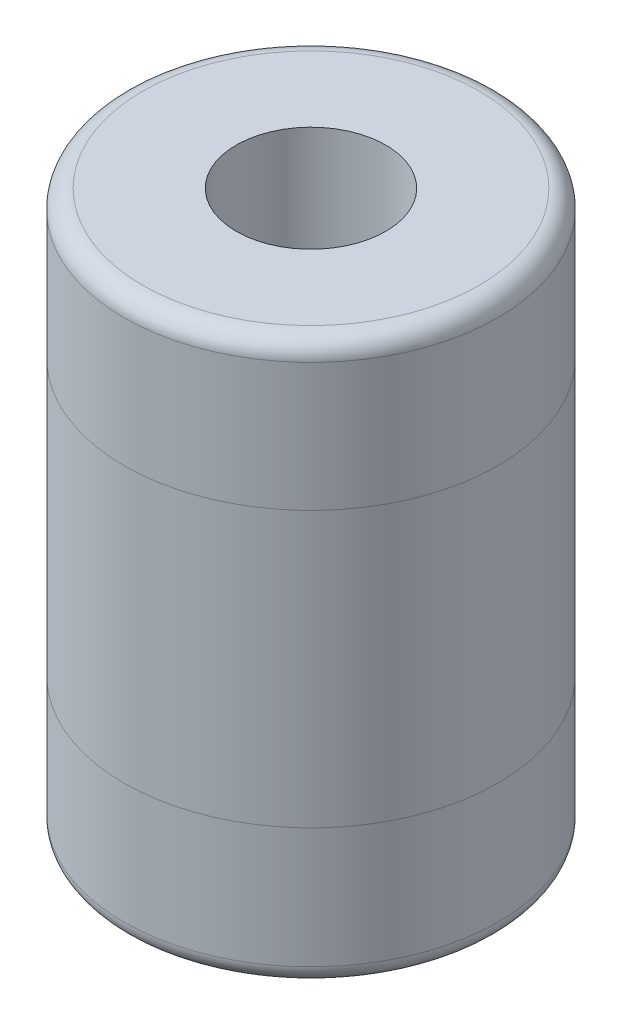
from build123d import *

# Parameters (mm, degrees)
SKETCH1_R           = 10
BOSS_EXTRUDE1_DEPTH = 15
SKETCH2_R           = 4
CUT_EXTRUDE1_DEPTH  = 34.166247904
FILLET1_R           = 1


with BuildPart() as part:
    # Sketch1 → Boss-Extrude1 (new, symmetric)
    with BuildSketch(Plane(origin=(0, 0, 0), x_dir=(1, 0, 0), z_dir=(0, 1, 0))):
        with Locations(Location((0, 0, 0), (0, 0, 270))):
            Circle(SKETCH1_R)
    extrude(amount=BOSS_EXTRUDE1_DEPTH, both=True)

    # Sketch2 → Cut-Extrude1 (cut, through all)
    with BuildSketch(Plane(origin=(0, 15, 0), x_dir=(1, 0, 0), z_dir=(0, 1, 0))):
        with Locations(Location((0, 0, 0), (0, 0, 270))):
            Circle(SKETCH2_R)
    extrude(amount=-CUT_EXTRUDE1_DEPTH, mode=Mode.SUBTRACT)

    # Fillet1
    fillet1_edges = [part.edges().sort_by_distance(p)[0] for p in [
        (0, -15, -10),
        (0, 15, -10),
    ]]
    fillet(fillet1_edges, radius=FILLET1_R)


solid = part.part
